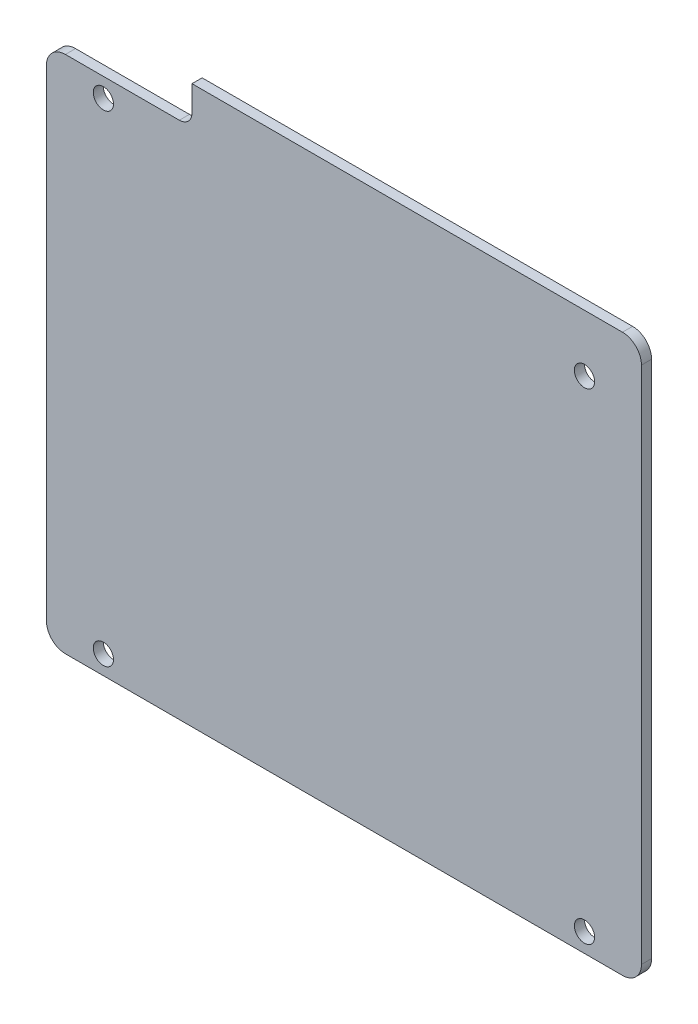
from build123d import *

# Parameters (mm, degrees)
BOSS_EXTRUDE1_DEPTH        = 1.6
F_3_2_3_2_DIAMETER_HOLE3_D = 3.2


with BuildPart() as part:
    # Sketch1 → Boss-Extrude1 (new body)
    with BuildSketch(Plane.XY):
        with BuildLine():
            Line((-87.56534388, 82.95185693), (-87.56534388, 6.95185693))
            ThreePointArc((-87.56534388, 6.95185693), (-86.686664224, 4.830536587), (-84.56534388, 3.95185693))
            Line((-84.56534388, 3.95185693), (3.43465612, 3.95185693))
            ThreePointArc((3.43465612, 3.95185693), (5.555976464, 4.830536587), (6.43465612, 6.95185693))
            Line((6.43465612, 6.95185693), (6.43465612, 88.95185693))
            ThreePointArc((6.43465612, 88.95185693), (5.555976464, 91.073177274), (3.43465612, 91.95185693))
            Line((3.43465612, 91.95185693), (0.93465612, 91.95185693))
            Line((0.93465612, 91.95185693), (-64.56534388, 91.95185693))
            Line((-64.56534388, 91.95185693), (-64.56534388, 87.95185693))
            ThreePointArc((-64.56534388, 87.95185693), (-65.151130318, 86.537643368), (-66.56534388, 85.95185693))
            Line((-66.56534388, 85.95185693), (-84.56534388, 85.95185693))
            ThreePointArc((-84.56534388, 85.95185693), (-86.686664224, 85.073177274), (-87.56534388, 82.95185693))
        make_face()
    extrude(amount=BOSS_EXTRUDE1_DEPTH)

    # Ø3.2 (3.2) Diameter Hole3 (through all)
    with Locations(Plane(origin=(0, 0, 0), x_dir=(-1, 0, 0), z_dir=(0, 0, -1))):
        with Locations((78.56534388, 6.95185693), (78.56534388, 82.95185693), (2.56534388, 82.95185693), (2.56534388, 6.95185693)):
            Hole(F_3_2_3_2_DIAMETER_HOLE3_D / 2)


solid = part.part
